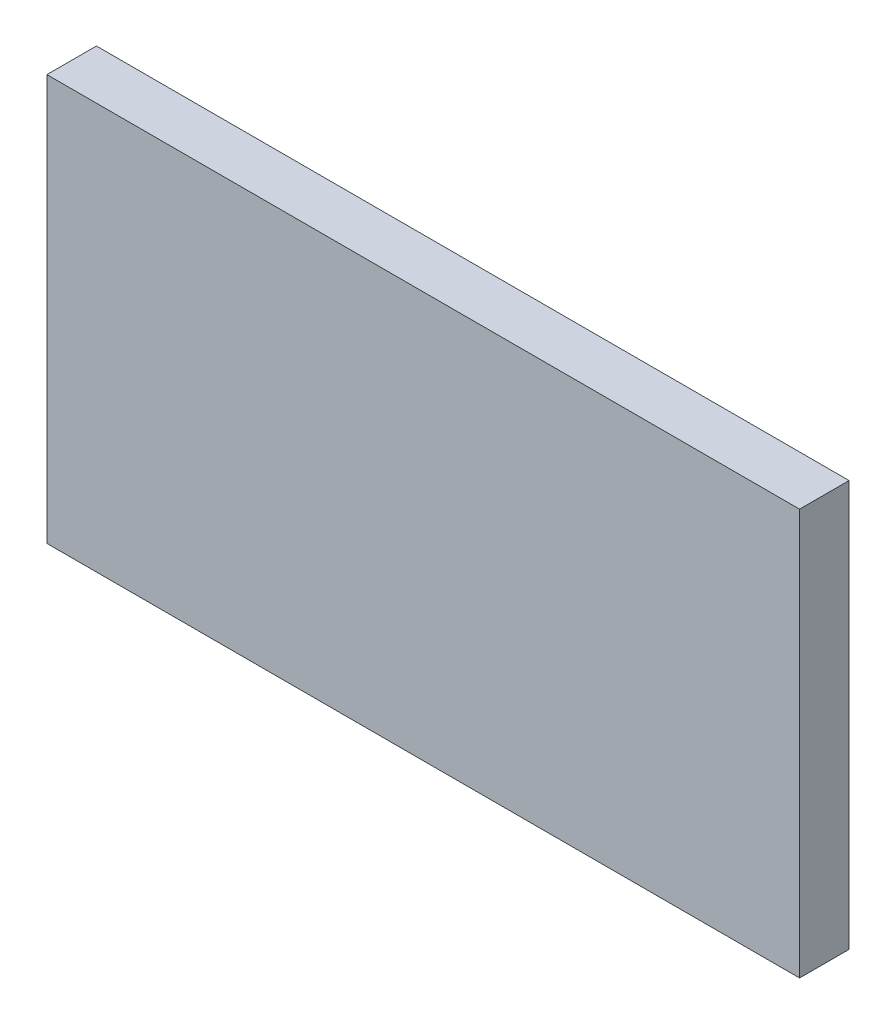
from build123d import *

# Parameters (mm, degrees)
ESQUISSE1_W        = 304
ESQUISSE1_H        = 164
BOSS_EXTRU_1_DEPTH = 20


with BuildPart() as part:
    # Esquisse1 → Boss.-Extru.1 (new body)
    with BuildSketch(Plane.XY):
        Rectangle(ESQUISSE1_W, ESQUISSE1_H)
    extrude(amount=BOSS_EXTRU_1_DEPTH)


solid = part.part
